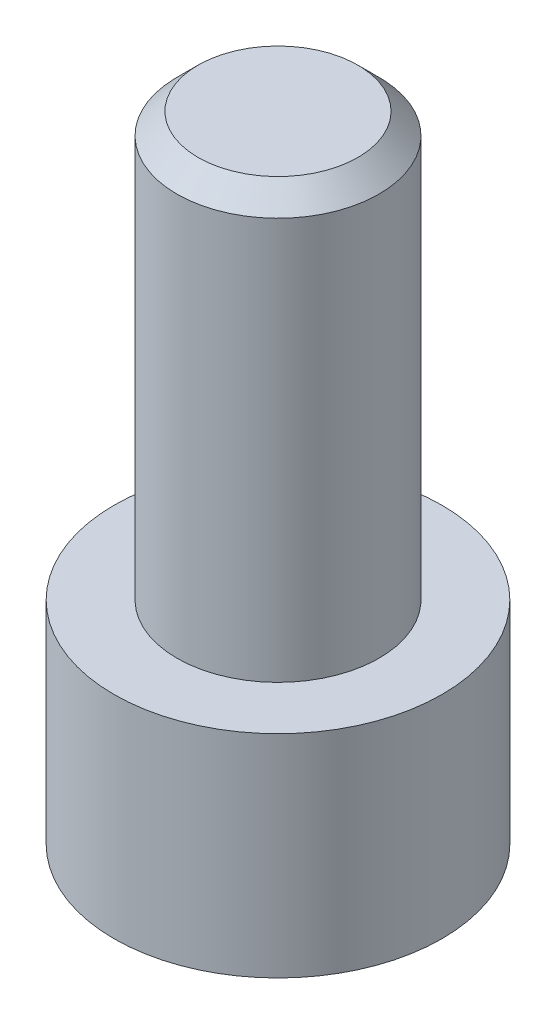
from build123d import *

# Parameters (mm, degrees)
SKETCH1_R           = 3.875
BOSS_EXTRUDE1_DEPTH = 15
SKETCH2_OUTSIDE_W   = 13.466
SKETCH2_OUTSIDE_H   = 13.466
SKETCH2_OUTSIDE_R   = 2.39
CUT_EXTRUDE1_DEPTH  = 10
CHAMFER1_SIZE       = 0.5
CUT_EXTRUDE2_DEPTH  = 3.36


with BuildPart() as part:
    # Sketch1 → Boss-Extrude1 (new body)
    with BuildSketch(Plane(origin=(0, 0, 0), x_dir=(1, 0, 0), z_dir=(0, 1, 0))):
        Circle(SKETCH1_R)
    extrude(amount=BOSS_EXTRUDE1_DEPTH)

    # Sketch2 outside → Cut-Extrude1 (cut)
    with BuildSketch(Plane(origin=(0, 15, 0), x_dir=(1, 0, 0), z_dir=(0, 1, 0))):
        Rectangle(SKETCH2_OUTSIDE_W, SKETCH2_OUTSIDE_H)
        Circle(SKETCH2_OUTSIDE_R, mode=Mode.SUBTRACT)
    extrude(amount=-CUT_EXTRUDE1_DEPTH, mode=Mode.SUBTRACT)

    # Chamfer1
    chamfer1_edges = [part.edges().sort_by_distance(p)[0] for p in [
        (-2.39, 15, 0),
    ]]
    chamfer(chamfer1_edges, length=CHAMFER1_SIZE)

    # Sketch8 → Cut-Extrude2 (cut)
    with BuildSketch(Plane.XZ):
        Polygon((2.644264233, 0), (1.322132116, 2.29), (-1.322132116, 2.29), (-2.644264233, 0), (-1.322132116, -2.29), (1.322132116, -2.29), align=None)
    extrude(amount=-CUT_EXTRUDE2_DEPTH, mode=Mode.SUBTRACT)


solid = part.part
